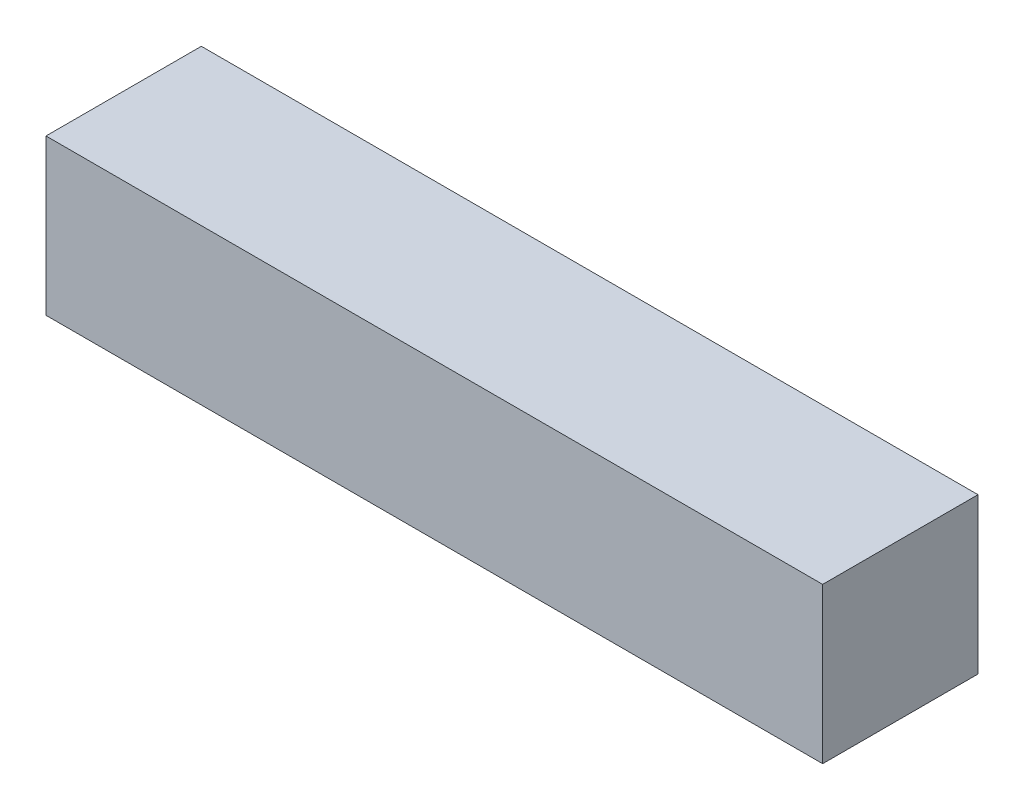
from build123d import *

# Parameters (mm, degrees)
SKETCH1_W           = 100
SKETCH1_H           = 20
BOSS_EXTRUDE1_DEPTH = 20


with BuildPart() as part:
    # Sketch1 → Boss-Extrude1 (new body)
    with BuildSketch(Plane.XY):
        Rectangle(SKETCH1_W, SKETCH1_H)
    extrude(amount=BOSS_EXTRUDE1_DEPTH)


solid = part.part
